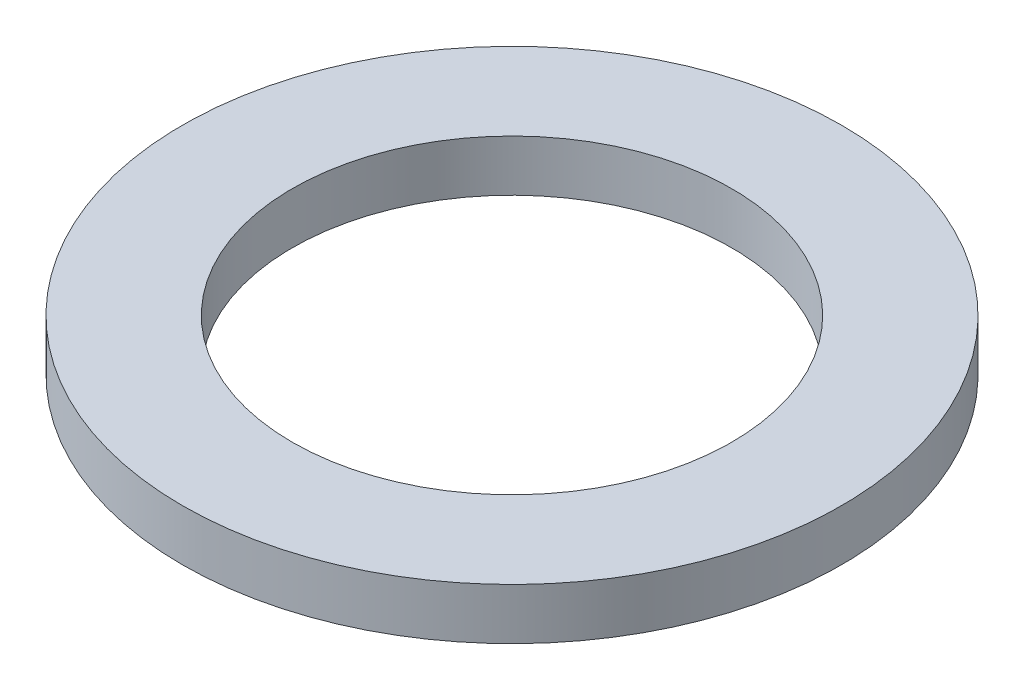
from build123d import *

# Parameters (mm, degrees)
SKETCH1_R           = 11.43
SKETCH1_R_2         = 7.62
BOSS_EXTRUDE1_DEPTH = 1.778


with BuildPart() as part:
    # Sketch1 → Boss-Extrude1 (new body)
    with BuildSketch(Plane(origin=(0, 0, 0), x_dir=(1, 0, 0), z_dir=(0, 1, 0))):
        with Locations(Location((0, 0, 0), (0, 0, 270))):
            Circle(SKETCH1_R)
        with Locations(Location((0, 0, 0), (0, 0, 270))):
            Circle(SKETCH1_R_2, mode=Mode.SUBTRACT)
    extrude(amount=BOSS_EXTRUDE1_DEPTH)


solid = part.part
